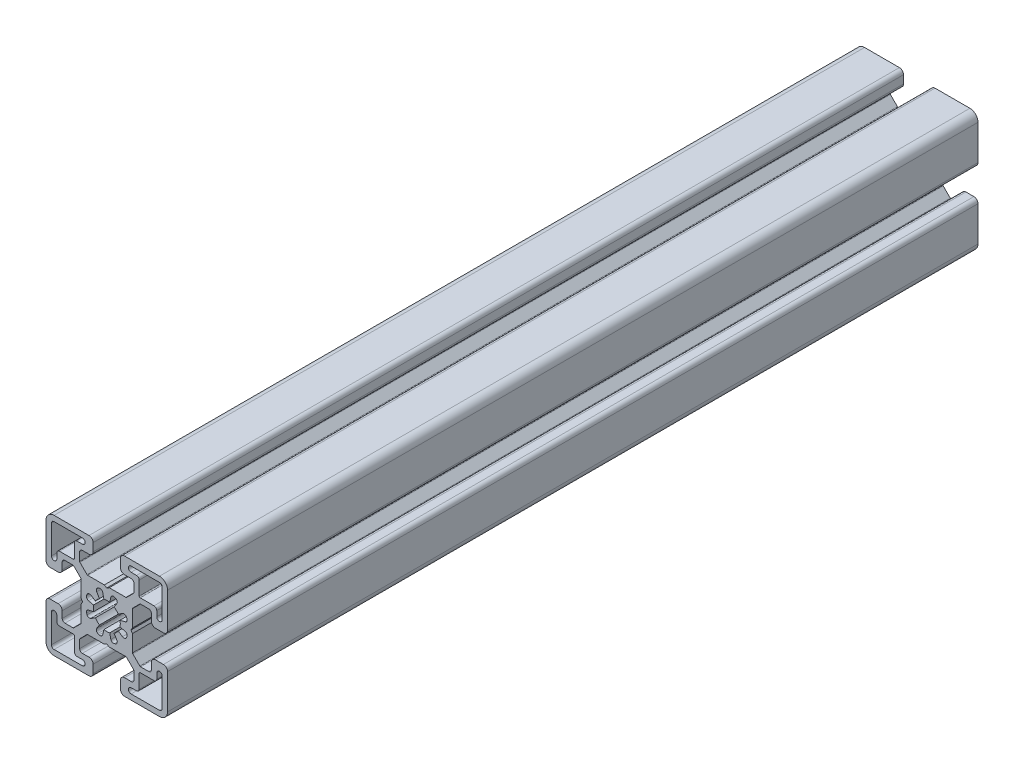
from build123d import *

# Parameters (mm, degrees)
EXTRUDE1_DEPTH = 300


with BuildPart() as part:
    # Sketch1 → Extrude1 (new body)
    with BuildSketch(Plane.XY):
        with BuildLine():
            Line((2.070696762, -5.483119356), (2.970696689, -4.967971313))
            Line((2.970696689, -4.967971313), (3.870696615, -5.483119356))
            Line((3.870696615, -5.483119356), (10.022269564, -5.483119356))
            ThreePointArc((10.022269564, -5.483119356), (10.167689268, -5.512045134), (10.290970141, -5.59441878))
            Line((10.290970141, -5.59441878), (12.909397265, -8.212845904))
            ThreePointArc((12.909397265, -8.212845904), (12.991770911, -8.336126777), (13.020696689, -8.481546481))
            Line((13.020696689, -8.481546481), (13.020696689, -11.483119356))
            ThreePointArc((13.020696689, -11.483119356), (12.72780347, -12.190226138), (12.020696689, -12.483119356))
            Line((12.020696689, -12.483119356), (9.555696689, -12.483119356))
            ThreePointArc((9.555696689, -12.483119356), (8.480894381, -12.928317049), (8.035696689, -14.003119356))
            Line((8.035696689, -14.003119356), (8.035696689, -16.963119356))
            ThreePointArc((8.035696689, -16.963119356), (8.480894381, -18.037921664), (9.555696689, -18.483119356))
            Line((9.555696689, -18.483119356), (22.470696689, -18.483119356))
            ThreePointArc((22.470696689, -18.483119356), (24.592017032, -17.6044397), (25.470696689, -15.483119356))
            Line((25.470696689, -15.483119356), (25.470696689, -2.568119356))
            ThreePointArc((25.470696689, -2.568119356), (25.025498996, -1.493317049), (23.950696689, -1.048119356))
            Line((23.950696689, -1.048119356), (20.990696689, -1.048119356))
            ThreePointArc((20.990696689, -1.048119356), (19.915894381, -1.493317049), (19.470696689, -2.568119356))
            Line((19.470696689, -2.568119356), (19.470696689, -5.033119356))
            ThreePointArc((19.470696689, -5.033119356), (19.17780347, -5.740226138), (18.470696689, -6.033119356))
            Line((18.470696689, -6.033119356), (15.469123813, -6.033119356))
            ThreePointArc((15.469123813, -6.033119356), (15.323704109, -6.004193579), (15.200423236, -5.921819933))
            Line((15.200423236, -5.921819933), (12.581996112, -3.303392809))
            ThreePointArc((12.581996112, -3.303392809), (12.499622466, -3.180111936), (12.470696689, -3.034692232))
            Line((12.470696689, -3.034692232), (12.470696689, 3.116881008))
            Line((12.470696689, 3.116881008), (11.951083419, 4.016880644))
            Line((11.951083419, 4.016880644), (12.470696689, 4.916880279))
            Line((12.470696689, 4.916880279), (12.470696689, 11.068453519))
            ThreePointArc((12.470696689, 11.068453519), (12.499622466, 11.213873223), (12.581996112, 11.337154096))
            Line((12.581996112, 11.337154096), (15.200423236, 13.95558122))
            ThreePointArc((15.200423236, 13.95558122), (15.323704109, 14.037954866), (15.469123813, 14.066880644))
            Line((15.469123813, 14.066880644), (18.470696689, 14.066880644))
            ThreePointArc((18.470696689, 14.066880644), (19.17780347, 13.773987425), (19.470696689, 13.066880644))
            Line((19.470696689, 13.066880644), (19.470696689, 10.601880644))
            ThreePointArc((19.470696689, 10.601880644), (19.915894381, 9.527078336), (20.990696689, 9.081880644))
            Line((20.990696689, 9.081880644), (23.950696689, 9.081880644))
            ThreePointArc((23.950696689, 9.081880644), (25.025498996, 9.527078336), (25.470696689, 10.601880644))
            Line((25.470696689, 10.601880644), (25.470696689, 23.516880644))
            ThreePointArc((25.470696689, 23.516880644), (24.592017032, 25.638200987), (22.470696689, 26.516880644))
            Line((22.470696689, 26.516880644), (9.555696689, 26.516880644))
            ThreePointArc((9.555696689, 26.516880644), (8.480894381, 26.071682951), (8.035696689, 24.996880644))
            Line((8.035696689, 24.996880644), (8.035696689, 22.036880644))
            ThreePointArc((8.035696689, 22.036880644), (8.480894381, 20.962078336), (9.555696689, 20.516880644))
            Line((9.555696689, 20.516880644), (12.020696689, 20.516880644))
            ThreePointArc((12.020696689, 20.516880644), (12.72780347, 20.223987425), (13.020696689, 19.516880644))
            Line((13.020696689, 19.516880644), (13.020696689, 16.515307768))
            ThreePointArc((13.020696689, 16.515307768), (12.991770911, 16.369888064), (12.909397265, 16.246607191))
            Line((12.909397265, 16.246607191), (10.290970141, 13.628180067))
            ThreePointArc((10.290970141, 13.628180067), (10.167689268, 13.545806421), (10.022269564, 13.516880644))
            Line((10.022269564, 13.516880644), (3.870696615, 13.516880644))
            Line((3.870696615, 13.516880644), (2.970696689, 13.0017326))
            Line((2.970696689, 13.0017326), (2.070696762, 13.516880644))
            Line((2.070696762, 13.516880644), (-4.080876187, 13.516880644))
            ThreePointArc((-4.080876187, 13.516880644), (-4.226295891, 13.545806421), (-4.349576764, 13.628180067))
            Line((-4.349576764, 13.628180067), (-6.968003888, 16.246607191))
            ThreePointArc((-6.968003888, 16.246607191), (-7.050377534, 16.369888064), (-7.079303311, 16.515307768))
            Line((-7.079303311, 16.515307768), (-7.079303311, 19.516880644))
            ThreePointArc((-7.079303311, 19.516880644), (-6.786410093, 20.223987425), (-6.079303311, 20.516880644))
            Line((-6.079303311, 20.516880644), (-3.614303311, 20.516880644))
            ThreePointArc((-3.614303311, 20.516880644), (-2.539501004, 20.962078336), (-2.094303311, 22.036880644))
            Line((-2.094303311, 22.036880644), (-2.094303311, 24.996880644))
            ThreePointArc((-2.094303311, 24.996880644), (-2.539501004, 26.071682951), (-3.614303311, 26.516880644))
            Line((-3.614303311, 26.516880644), (-16.529303311, 26.516880644))
            ThreePointArc((-16.529303311, 26.516880644), (-18.650623655, 25.638200987), (-19.529303311, 23.516880644))
            Line((-19.529303311, 23.516880644), (-19.529303311, 10.601880644))
            ThreePointArc((-19.529303311, 10.601880644), (-19.084105619, 9.527078336), (-18.009303311, 9.081880644))
            Line((-18.009303311, 9.081880644), (-15.049303311, 9.081880644))
            ThreePointArc((-15.049303311, 9.081880644), (-13.974501004, 9.527078336), (-13.529303311, 10.601880644))
            Line((-13.529303311, 10.601880644), (-13.529303311, 13.066880644))
            ThreePointArc((-13.529303311, 13.066880644), (-13.236410093, 13.773987425), (-12.529303311, 14.066880644))
            Line((-12.529303311, 14.066880644), (-9.527730436, 14.066880644))
            ThreePointArc((-9.527730436, 14.066880644), (-9.382310732, 14.037954866), (-9.259029859, 13.95558122))
            Line((-9.259029859, 13.95558122), (-6.640602735, 11.337154096))
            ThreePointArc((-6.640602735, 11.337154096), (-6.558229089, 11.213873223), (-6.529303311, 11.068453519))
            Line((-6.529303311, 11.068453519), (-6.529303311, 4.916880279))
            Line((-6.529303311, 4.916880279), (-6.009690042, 4.016880644))
            Line((-6.009690042, 4.016880644), (-6.529303311, 3.116881008))
            Line((-6.529303311, 3.116881008), (-6.529303311, -3.034692232))
            ThreePointArc((-6.529303311, -3.034692232), (-6.558229089, -3.180111936), (-6.640602735, -3.303392809))
            Line((-6.640602735, -3.303392809), (-9.259029859, -5.921819933))
            ThreePointArc((-9.259029859, -5.921819933), (-9.382310732, -6.004193579), (-9.527730436, -6.033119356))
            Line((-9.527730436, -6.033119356), (-12.529303311, -6.033119356))
            ThreePointArc((-12.529303311, -6.033119356), (-13.236410093, -5.740226138), (-13.529303311, -5.033119356))
            Line((-13.529303311, -5.033119356), (-13.529303311, -2.568119356))
            ThreePointArc((-13.529303311, -2.568119356), (-13.974501004, -1.493317049), (-15.049303311, -1.048119356))
            Line((-15.049303311, -1.048119356), (-18.009303311, -1.048119356))
            ThreePointArc((-18.009303311, -1.048119356), (-19.084105619, -1.493317049), (-19.529303311, -2.568119356))
            Line((-19.529303311, -2.568119356), (-19.529303311, -15.483119356))
            ThreePointArc((-19.529303311, -15.483119356), (-18.650623655, -17.6044397), (-16.529303311, -18.483119356))
            Line((-16.529303311, -18.483119356), (-3.614303311, -18.483119356))
            ThreePointArc((-3.614303311, -18.483119356), (-2.539501004, -18.037921664), (-2.094303311, -16.963119356))
            Line((-2.094303311, -16.963119356), (-2.094303311, -14.003119356))
            ThreePointArc((-2.094303311, -14.003119356), (-2.539501004, -12.928317049), (-3.614303311, -12.483119356))
            Line((-3.614303311, -12.483119356), (-6.079303311, -12.483119356))
            ThreePointArc((-6.079303311, -12.483119356), (-6.786410093, -12.190226138), (-7.079303311, -11.483119356))
            Line((-7.079303311, -11.483119356), (-7.079303311, -8.481546481))
            ThreePointArc((-7.079303311, -8.481546481), (-7.050377534, -8.336126777), (-6.968003888, -8.212845904))
            Line((-6.968003888, -8.212845904), (-4.349576764, -5.59441878))
            ThreePointArc((-4.349576764, -5.59441878), (-4.226295891, -5.512045134), (-4.080876187, -5.483119356))
            Line((-4.080876187, -5.483119356), (2.070696762, -5.483119356))
        make_face()
        with BuildLine():
            Line((-8.029303311, -14.483119356), (-6.029303311, -14.483119356))
            ThreePointArc((-6.029303311, -14.483119356), (-5.029303311, -15.483119356), (-6.029303311, -16.483119356))
            Line((-6.029303311, -16.483119356), (-16.529303311, -16.483119356))
            ThreePointArc((-16.529303311, -16.483119356), (-17.236410093, -16.190226138), (-17.529303311, -15.483119356))
            Line((-17.529303311, -15.483119356), (-17.529303311, -4.983119356))
            ThreePointArc((-17.529303311, -4.983119356), (-16.529303311, -3.983119356), (-15.529303311, -4.983119356))
            Line((-15.529303311, -4.983119356), (-15.529303311, -6.983119356))
            ThreePointArc((-15.529303311, -6.983119356), (-15.236410093, -7.690226138), (-14.529303311, -7.983119356))
            Line((-14.529303311, -7.983119356), (-9.409303311, -7.983119356))
            ThreePointArc((-9.409303311, -7.983119356), (-9.140602735, -8.09441878), (-9.029303311, -8.363119356))
            Line((-9.029303311, -8.363119356), (-9.029303311, -13.483119356))
            ThreePointArc((-9.029303311, -13.483119356), (-8.736410093, -14.190226138), (-8.029303311, -14.483119356))
        make_face(mode=Mode.SUBTRACT)
        with BuildLine():
            Line((-15.529303311, 15.016880644), (-15.529303311, 13.016880644))
            ThreePointArc((-15.529303311, 13.016880644), (-16.529303311, 12.016880644), (-17.529303311, 13.016880644))
            Line((-17.529303311, 13.016880644), (-17.529303311, 23.516880644))
            ThreePointArc((-17.529303311, 23.516880644), (-17.236410093, 24.223987425), (-16.529303311, 24.516880644))
            Line((-16.529303311, 24.516880644), (-6.029303311, 24.516880644))
            ThreePointArc((-6.029303311, 24.516880644), (-5.029303311, 23.516880644), (-6.029303311, 22.516880644))
            Line((-6.029303311, 22.516880644), (-8.029303311, 22.516880644))
            ThreePointArc((-8.029303311, 22.516880644), (-8.736410093, 22.223987425), (-9.029303311, 21.516880644))
            Line((-9.029303311, 21.516880644), (-9.029303311, 16.396880644))
            ThreePointArc((-9.029303311, 16.396880644), (-9.140602735, 16.128180067), (-9.409303311, 16.016880644))
            Line((-9.409303311, 16.016880644), (-14.529303311, 16.016880644))
            ThreePointArc((-14.529303311, 16.016880644), (-15.236410093, 15.723987425), (-15.529303311, 15.016880644))
        make_face(mode=Mode.SUBTRACT)
        with BuildLine():
            Line((14.970696689, 16.396880644), (14.970696689, 21.516880644))
            ThreePointArc((14.970696689, 21.516880644), (14.67780347, 22.223987425), (13.970696689, 22.516880644))
            Line((13.970696689, 22.516880644), (11.970696689, 22.516880644))
            ThreePointArc((11.970696689, 22.516880644), (10.970696689, 23.516880644), (11.970696689, 24.516880644))
            Line((11.970696689, 24.516880644), (22.470696689, 24.516880644))
            ThreePointArc((22.470696689, 24.516880644), (23.17780347, 24.223987425), (23.470696689, 23.516880644))
            Line((23.470696689, 23.516880644), (23.470696689, 13.016880644))
            ThreePointArc((23.470696689, 13.016880644), (22.470696689, 12.016880644), (21.470696689, 13.016880644))
            Line((21.470696689, 13.016880644), (21.470696689, 15.016880644))
            ThreePointArc((21.470696689, 15.016880644), (21.17780347, 15.723987425), (20.470696689, 16.016880644))
            Line((20.470696689, 16.016880644), (15.350696689, 16.016880644))
            ThreePointArc((15.350696689, 16.016880644), (15.081996112, 16.128180067), (14.970696689, 16.396880644))
        make_face(mode=Mode.SUBTRACT)
        with BuildLine():
            Line((8.813667521, 0.293110828), (7.186693868, 1.328876219))
            ThreePointArc((7.186693868, 1.328876219), (6.506092102, 0.48120825), (5.658370816, -0.199327106))
            Line((5.658370816, -0.199327106), (6.694267562, -1.8260382))
            ThreePointArc((6.694267562, -1.8260382), (6.809058347, -2.648996527), (6.26221419, -3.274615262))
            ThreePointArc((6.26221419, -3.274615262), (6.032089534, -3.374186522), (5.798957452, -3.466497007))
            ThreePointArc((5.798957452, -3.466497007), (4.969968429, -3.410814072), (4.469198099, -2.747826542))
            Line((4.469198099, -2.747826542), (4.051150727, -0.864985708))
            ThreePointArc((4.051150727, -0.864985708), (2.970500834, -0.983119353), (1.889860199, -0.864901048))
            Line((1.889860199, -0.864901048), (1.472091367, -2.747649108))
            ThreePointArc((1.472091367, -2.747649108), (0.971341296, -3.410737864), (0.142284835, -3.466439902))
            ThreePointArc((0.142284835, -3.466439902), (-0.090845384, -3.37412471), (-0.32096803, -3.274548804))
            ThreePointArc((-0.32096803, -3.274548804), (-0.867778008, -2.648991264), (-0.753073127, -1.826090189))
            Line((-0.753073127, -1.826090189), (0.282692264, -0.199116535))
            ThreePointArc((0.282692264, -0.199116535), (-0.564975705, 0.48148523), (-1.245511061, 1.329206516))
            Line((-1.245511061, 1.329206516), (-2.872222155, 0.29330977))
            ThreePointArc((-2.872222155, 0.29330977), (-3.695180482, 0.178518985), (-4.320799217, 0.725363142))
            ThreePointArc((-4.320799217, 0.725363142), (-4.420370477, 0.955487798), (-4.512680962, 1.18861988))
            ThreePointArc((-4.512680962, 1.18861988), (-4.456998027, 2.017608903), (-3.794010497, 2.518379234))
            Line((-3.794010497, 2.518379234), (-1.911169663, 2.936426605))
            ThreePointArc((-1.911169663, 2.936426605), (-2.029303308, 4.017076498), (-1.911085003, 5.097717133))
            Line((-1.911085003, 5.097717133), (-3.793833063, 5.515485965))
            ThreePointArc((-3.793833063, 5.515485965), (-4.456921819, 6.016236036), (-4.512623857, 6.845292497))
            ThreePointArc((-4.512623857, 6.845292497), (-4.420308665, 7.078422716), (-4.320732759, 7.308545362))
            ThreePointArc((-4.320732759, 7.308545362), (-3.695175219, 7.85535534), (-2.872274144, 7.740650459))
            Line((-2.872274144, 7.740650459), (-1.24530049, 6.704885068))
            ThreePointArc((-1.24530049, 6.704885068), (-0.564698724, 7.552553037), (0.283022561, 8.233088393))
            Line((0.283022561, 8.233088393), (-0.752874185, 9.859799487))
            ThreePointArc((-0.752874185, 9.859799487), (-0.86766497, 10.682757814), (-0.320820813, 11.308376549))
            ThreePointArc((-0.320820813, 11.308376549), (-0.090696157, 11.407947809), (0.142435925, 11.500258294))
            ThreePointArc((0.142435925, 11.500258294), (0.971424948, 11.444575359), (1.472195279, 10.781587829))
            Line((1.472195279, 10.781587829), (1.89024265, 8.898746995))
            ThreePointArc((1.89024265, 8.898746995), (2.970892543, 9.01688064), (4.051533178, 8.898662335))
            Line((4.051533178, 8.898662335), (4.46930201, 10.781410395))
            ThreePointArc((4.46930201, 10.781410395), (4.970052081, 11.444499151), (5.799108542, 11.500201189))
            ThreePointArc((5.799108542, 11.500201189), (6.032238761, 11.407885997), (6.262361407, 11.308310091))
            ThreePointArc((6.262361407, 11.308310091), (6.809171385, 10.682752551), (6.694466504, 9.859851476))
            Line((6.694466504, 9.859851476), (5.658701113, 8.232877822))
            ThreePointArc((5.658701113, 8.232877822), (6.506369082, 7.552276057), (7.186904438, 6.704554771))
            Line((7.186904438, 6.704554771), (8.813615532, 7.740451517))
            ThreePointArc((8.813615532, 7.740451517), (9.636573859, 7.855242302), (10.262192594, 7.308398145))
            ThreePointArc((10.262192594, 7.308398145), (10.361763854, 7.078273489), (10.454074339, 6.845141407))
            ThreePointArc((10.454074339, 6.845141407), (10.398391404, 6.016152384), (9.735403874, 5.515382054))
            Line((9.735403874, 5.515382054), (7.85256304, 5.097334682))
            ThreePointArc((7.85256304, 5.097334682), (7.970696685, 4.016684789), (7.85247838, 2.936044154))
            Line((7.85247838, 2.936044154), (9.73522644, 2.518275322))
            ThreePointArc((9.73522644, 2.518275322), (10.398315196, 2.017525251), (10.454017234, 1.18846879))
            ThreePointArc((10.454017234, 1.18846879), (10.361702042, 0.955338571), (10.262126136, 0.725215925))
            ThreePointArc((10.262126136, 0.725215925), (9.636568596, 0.178405947), (8.813667521, 0.293110828))
        make_face(mode=Mode.SUBTRACT)
        with BuildLine():
            Line((21.470696689, -6.983119356), (21.470696689, -4.983119356))
            ThreePointArc((21.470696689, -4.983119356), (22.470696689, -3.983119356), (23.470696689, -4.983119356))
            Line((23.470696689, -4.983119356), (23.470696689, -15.483119356))
            ThreePointArc((23.470696689, -15.483119356), (23.17780347, -16.190226138), (22.470696689, -16.483119356))
            Line((22.470696689, -16.483119356), (11.970696689, -16.483119356))
            ThreePointArc((11.970696689, -16.483119356), (10.970696689, -15.483119356), (11.970696689, -14.483119356))
            Line((11.970696689, -14.483119356), (13.970696689, -14.483119356))
            ThreePointArc((13.970696689, -14.483119356), (14.67780347, -14.190226138), (14.970696689, -13.483119356))
            Line((14.970696689, -13.483119356), (14.970696689, -8.363119356))
            ThreePointArc((14.970696689, -8.363119356), (15.081996112, -8.09441878), (15.350696689, -7.983119356))
            Line((15.350696689, -7.983119356), (20.470696689, -7.983119356))
            ThreePointArc((20.470696689, -7.983119356), (21.17780347, -7.690226138), (21.470696689, -6.983119356))
        make_face(mode=Mode.SUBTRACT)
    extrude(amount=EXTRUDE1_DEPTH)


solid = part.part
